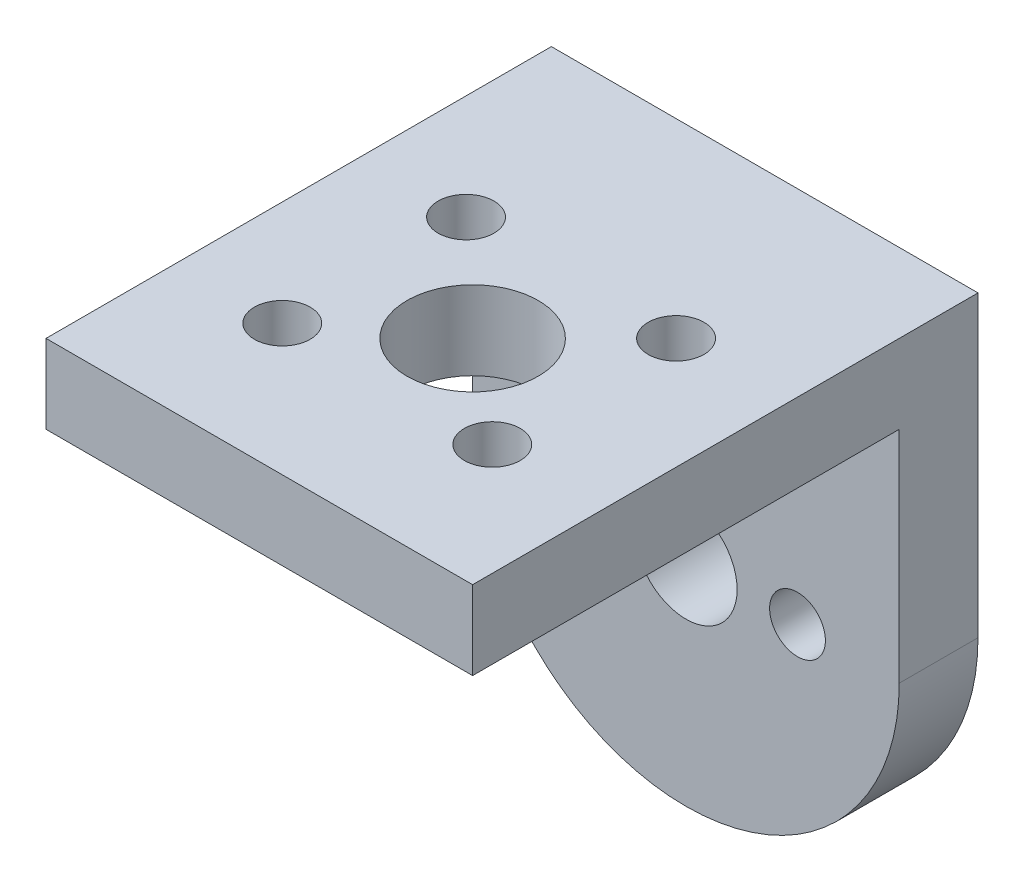
from build123d import *

# Parameters (mm, degrees)
SKETCH1_W           = 32.5
SKETCH1_H           = 32.5
SKETCH1_R           = 2.125
SKETCH1_R_2         = 5
BOSS_EXTRUDE1_DEPTH = 6
SKETCH2_W           = 32.5
SKETCH2_H           = 6
BOSS_EXTRUDE2_DEPTH = 39
CUT_EXTRUDE1_DEPTH  = 39
SKETCH4_R           = 3.9
SKETCH4_R_2         = 2.125
CUT_EXTRUDE2_DEPTH  = 39


with BuildPart() as part:
    # Sketch1 → Boss-Extrude1 (new body)
    with BuildSketch(Plane(origin=(0, 0, 0), x_dir=(1, 0, 0), z_dir=(0, 1, 0))):
        with Locations((16.25, 16.25)):
            Rectangle(SKETCH1_W, SKETCH1_H)
        with Locations(Location((24, 10, 0), (0, 0, 270))):
            Circle(SKETCH1_R, mode=Mode.SUBTRACT)
        with Locations(Location((24, 24, 0), (0, 0, 270))):
            Circle(SKETCH1_R, mode=Mode.SUBTRACT)
        with Locations(Location((8, 24, 0), (0, 0, 270))):
            Circle(SKETCH1_R, mode=Mode.SUBTRACT)
        with Locations(Location((8, 10, 0), (0, 0, 270))):
            Circle(SKETCH1_R, mode=Mode.SUBTRACT)
        with Locations(Location((16.25, 16.25, 0), (0, 0, 270))):
            Circle(SKETCH1_R_2, mode=Mode.SUBTRACT)
    extrude(amount=BOSS_EXTRUDE1_DEPTH)

    # Sketch2 → Boss-Extrude2 (add)
    with BuildSketch(Plane(origin=(0, 6, 0), x_dir=(1, 0, 0), z_dir=(0, 1, 0))):
        with Locations((16.25, 35.5)):
            Rectangle(SKETCH2_W, SKETCH2_H)
    extrude(amount=-BOSS_EXTRUDE2_DEPTH)

    # Sketch3 → Cut-Extrude1 (cut)
    with BuildSketch(Plane.XY.offset(-32.5)):
        with BuildLine():
            Line((16.25, -33), (32.5, -33))
            Line((32.5, -33), (32.5, -16.75))
            ThreePointArc((32.5, -16.75), (27.740485194, -28.240485194), (16.25, -33))
        make_face()
        with BuildLine():
            Line((0, -33), (16.25, -33))
            ThreePointArc((16.25, -33), (4.759514806, -28.240485194), (0, -16.75))
            Line((0, -16.75), (0, -33))
        make_face()
    extrude(amount=-CUT_EXTRUDE1_DEPTH, mode=Mode.SUBTRACT)

    # Sketch4 → Cut-Extrude2 (cut)
    with BuildSketch(Plane.XY.offset(-32.5)):
        with Locations((16.25, -16.75)):
            Circle(SKETCH4_R)
        with Locations((7.75, -16.75)):
            Circle(SKETCH4_R_2)
        with Locations((24.75, -16.75)):
            Circle(SKETCH4_R_2)
    extrude(amount=-CUT_EXTRUDE2_DEPTH, mode=Mode.SUBTRACT)


solid = part.part
